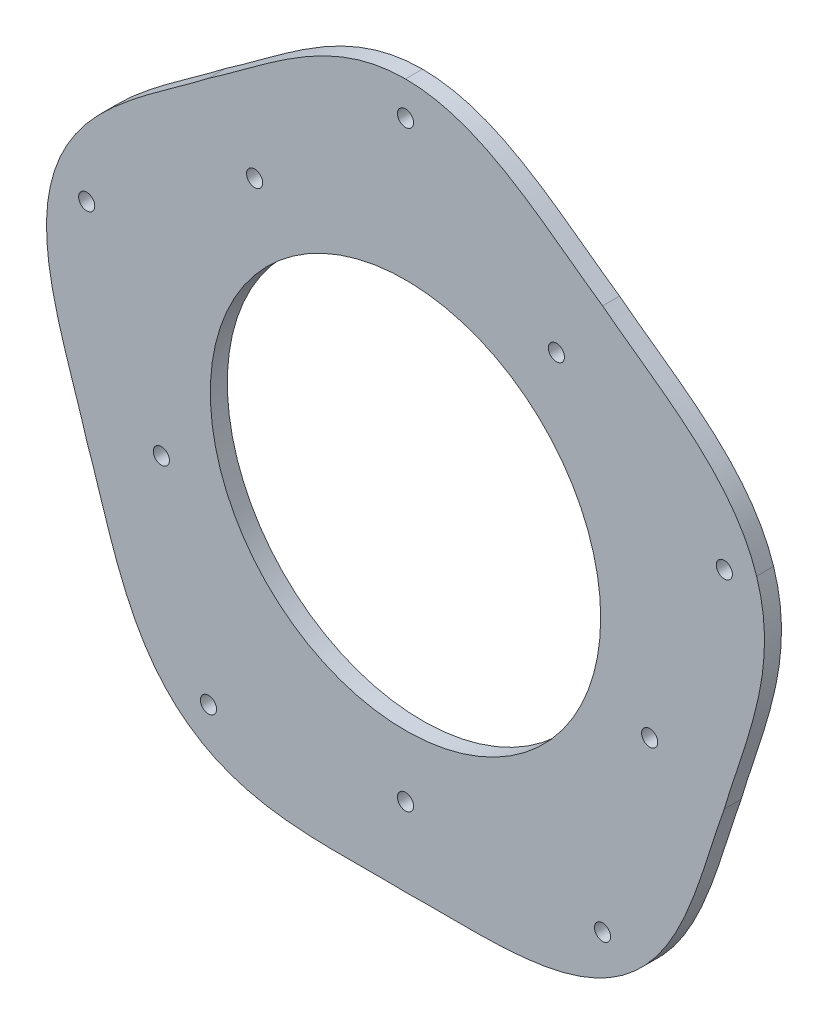
from build123d import *

# Parameters (mm, degrees)
SZKIC1_R                    = 1.9
SZKIC1_R_2                  = 46
DODANIE_WYCI_GNI_CIE1_DEPTH = 4


with BuildPart() as part:
    # Szkic1 → Dodanie-wyciągnięcie1 (new body)
    with BuildSketch(Plane.XY):
        with BuildLine():
            add(Edge.make_bspline(
                [(0, 87), (18.224844976, 86.998612649), (32.288902875, 73.536902698), (46.435034931, 63.912342556)],
                knots=[0, 0, 0, 0, 1, 1, 1, 1], degree=3))
            add(Edge.make_bspline(
                [(82.741916918, 26.884478511), (77.108810651, 44.216907368), (59.959930782, 53.43272413), (46.435034931, 63.912342556)],
                knots=[0, 0, 0, 0, 1, 1, 1, 1], degree=3))
            add(Edge.make_bspline(
                [(82.741916918, 26.884478511), (88.372384286, 9.551192223), (79.915570217, -7.984418835), (75.133464787, -24.412342556)],
                knots=[0, 0, 0, 0, 1, 1, 1, 1], degree=3))
            add(Edge.make_bspline(
                [(51.137316949, -70.384478511), (65.88071079, -59.671061018), (69.346178061, -40.513663074), (75.133464787, -24.412342556)],
                knots=[0, 0, 0, 0, 1, 1, 1, 1], degree=3))
            add(Edge.make_bspline(
                [(51.137316949, -70.384478511), (36.39229218, -81.095651222), (17.10163575, -78.471544919), (0, -79)],
                knots=[0, 0, 0, 0, 1, 1, 1, 1], degree=3))
            add(Edge.make_bspline(
                [(-51.137316949, -70.384478511), (-36.39229218, -81.095651222), (-17.10163575, -78.471544919), (0, -79)],
                knots=[0, 0, 0, 0, 1, 1, 1, 1], degree=3))
            add(Edge.make_bspline(
                [(-51.137316949, -70.384478511), (-65.88071079, -59.671061018), (-69.346178061, -40.513663074), (-75.133464787, -24.412342556)],
                knots=[0, 0, 0, 0, 1, 1, 1, 1], degree=3))
            add(Edge.make_bspline(
                [(-82.741916918, 26.884478511), (-88.372384286, 9.551192223), (-79.915570217, -7.984418835), (-75.133464787, -24.412342556)],
                knots=[0, 0, 0, 0, 1, 1, 1, 1], degree=3))
            add(Edge.make_bspline(
                [(-82.741916918, 26.884478511), (-77.108810651, 44.216907368), (-59.959930782, 53.43272413), (-46.435034931, 63.912342556)],
                knots=[0, 0, 0, 0, 1, 1, 1, 1], degree=3))
            add(Edge.make_bspline(
                [(0, 87), (-18.224844976, 86.998612649), (-32.288902875, 73.536902698), (-46.435034931, 63.912342556)],
                knots=[0, 0, 0, 0, 1, 1, 1, 1], degree=3))
        make_face()
        with Locations((0, 79)):
            Circle(SZKIC1_R, mode=Mode.SUBTRACT)
        with Locations((75.133464787, 24.412342556)):
            Circle(SZKIC1_R, mode=Mode.SUBTRACT)
        with Locations((46.435034931, -63.912342556)):
            Circle(SZKIC1_R, mode=Mode.SUBTRACT)
        with Locations((-46.435034931, -63.912342556)):
            Circle(SZKIC1_R, mode=Mode.SUBTRACT)
        with Locations((-75.133464787, 24.412342556)):
            Circle(SZKIC1_R, mode=Mode.SUBTRACT)
        Circle(SZKIC1_R_2, mode=Mode.SUBTRACT)
        with Locations((35.561007764, 48.94552816)):
            Circle(SZKIC1_R, mode=Mode.SUBTRACT)
        with Locations((57.538919236, -18.69552816)):
            Circle(SZKIC1_R, mode=Mode.SUBTRACT)
        with Locations((0, -60.5)):
            Circle(SZKIC1_R, mode=Mode.SUBTRACT)
        with Locations((-57.538919236, -18.69552816)):
            Circle(SZKIC1_R, mode=Mode.SUBTRACT)
        with Locations((-35.561007764, 48.94552816)):
            Circle(SZKIC1_R, mode=Mode.SUBTRACT)
    extrude(amount=DODANIE_WYCI_GNI_CIE1_DEPTH)


solid = part.part
